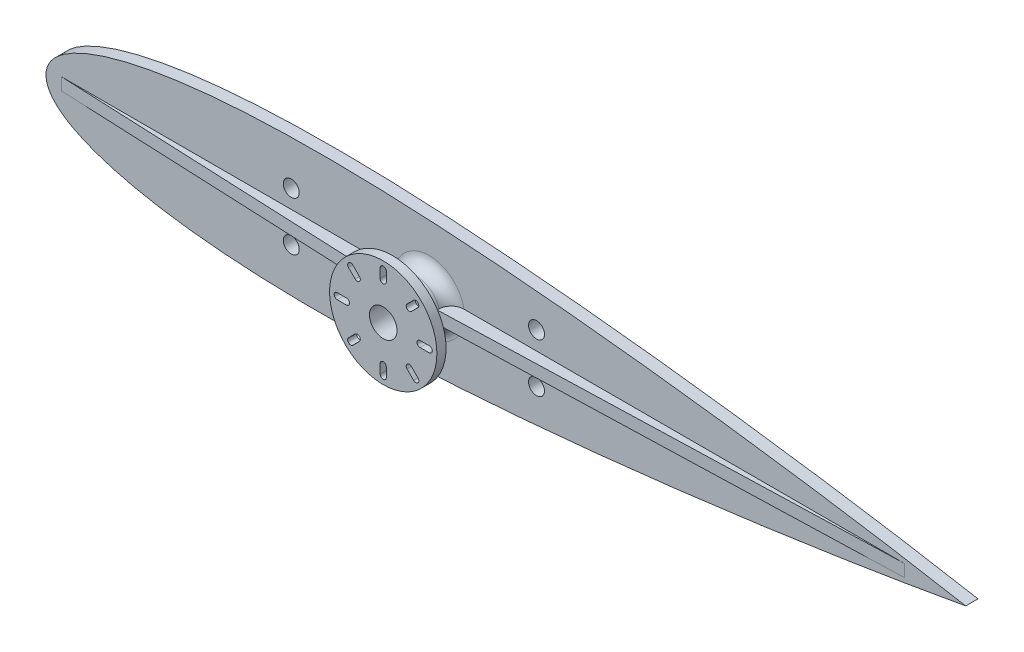
from build123d import *

# Parameters (mm, degrees)
SKETCH_1_R      = 4.5
SKETCH_1_R_2    = 2.6
EXTRUDE_1_DEPTH = 4
SKETCH_2_R      = 7.5
SKETCH_2_R_2    = 4.5
EXTRUDE_2_DEPTH = 12
RIB_7_REACH     = 303.268
SKETCH_4_WALL_W = 719.144994966
SKETCH_4_WALL_H = 4
RIB_8_REACH     = 303.268
SKETCH_5_WALL_W = 753.964961
SKETCH_5_WALL_H = 4
FILLET_1_R      = 4
SKETCH_6_R      = 17.5
SKETCH_6_R_2    = 4.5
EXTRUDE_3_DEPTH = 3


with BuildPart() as part:
    # 草图1 → 凸台-拉伸1 (new body)
    with BuildSketch(Plane.XY):
        with BuildLine():
            add(Edge.make_bspline(
                [(0, 0), (-9.5489e-05, -0.326407864), (0.030950281, -0.854000019), (0.150423202, -1.616777315), (0.448674258, -2.608935021), (0.848421592, -3.530047693), (1.433806351, -4.534449955), (2.263610744, -5.639668731), (3.456837907, -6.896675246), (5.225908513, -8.375867947), (7.906613431, -10.141837985), (11.989896233, -12.22562949), (18.321708513, -14.665606049), (27.826133031, -17.300188207), (41.974112353, -19.921000387), (60.222043604, -21.810463358), (78.624134319, -22.552186027), (95.988954389, -22.549739294), (113.345884106, -22.102249143), (130.689546496, -21.271088382), (148.01027967, -20.054961298), (165.306340091, -18.538013572), (179.703344131, -17.102052063), (191.21103146, -15.859228418), (201.272024493, -14.695659938), (209.889114389, -13.64726737), (217.06675899, -12.740467847), (222.804921516, -11.995811085), (229.977619163, -11.040364781), (238.573919489, -9.856643655), (248.605455284, -8.418167008), (258.611446595, -6.914785611), (267.201727162, -5.572315852), (274.322933639, -4.424865398), (280.072746677, -3.475406948), (285.700780324, -2.525508132), (290.829335304, -1.636879112), (294.873159607, -0.924080287), (298.04592284, -0.353968123), (299.35238804, -0.117662998), (300, 0)],
                knots=[0, 0, 0, 0, 0, 0.003840944, 0.006235023, 0.009072291, 0.01219322, 0.015656839, 0.019917177, 0.025338962, 0.032592504, 0.042799388, 0.05770457, 0.079310668, 0.112503101, 0.158972616, 0.227236465, 0.295500326, 0.329632258, 0.36376419, 0.432028053, 0.500291915, 0.534423847, 0.56855578, 0.602687711, 0.636819643, 0.653885609, 0.670951575, 0.688017542, 0.705083508, 0.739215439, 0.773347371, 0.807479302, 0.824545268, 0.841611234, 0.8586772, 0.875743167, 0.892809133, 0.901342117, 0.9098751, 0.9098751, 0.9098751, 0.9098751, 0.9098751], degree=4))
            add(Edge.make_bspline(
                [(0, 0), (-9.5489e-05, 0.326407864), (0.030950281, 0.854000019), (0.150423202, 1.616777315), (0.448674258, 2.608935021), (0.848421592, 3.530047693), (1.433806351, 4.534449955), (2.263610744, 5.639668731), (3.456837907, 6.896675246), (5.225908513, 8.375867947), (7.906613431, 10.141837985), (11.989896233, 12.22562949), (18.321708513, 14.665606049), (27.826133031, 17.300188207), (41.974112353, 19.921000387), (60.222043604, 21.810463358), (78.624134319, 22.552186027), (95.988954389, 22.549739295), (113.345884106, 22.102249143), (130.689546496, 21.271088382), (148.01027967, 20.054961298), (165.306340091, 18.538013572), (179.703344131, 17.102052063), (191.21103146, 15.859228418), (201.272024493, 14.695659938), (209.889114389, 13.64726737), (217.06675899, 12.740467847), (222.804921516, 11.995811086), (229.977619163, 11.040364781), (238.573919489, 9.856643655), (248.605455284, 8.418167008), (258.611446595, 6.914785611), (267.201727162, 5.572315852), (274.322933639, 4.424865398), (280.072746677, 3.475406948), (285.700780324, 2.525508132), (290.829335304, 1.636879112), (294.873159607, 0.924080288), (298.04592284, 0.353968123), (299.35238804, 0.117662998), (300, 0)],
                knots=[0, 0, 0, 0, 0, 0.003840944, 0.006235023, 0.009072291, 0.01219322, 0.015656839, 0.019917177, 0.025338962, 0.032592504, 0.042799388, 0.05770457, 0.079310668, 0.112503101, 0.158972616, 0.227236465, 0.295500326, 0.329632258, 0.36376419, 0.432028053, 0.500291915, 0.534423847, 0.56855578, 0.602687711, 0.636819643, 0.653885609, 0.670951575, 0.688017542, 0.705083508, 0.739215439, 0.773347371, 0.807479302, 0.824545268, 0.841611234, 0.8586772, 0.875743167, 0.892809133, 0.901342117, 0.9098751, 0.9098751, 0.9098751, 0.9098751, 0.9098751], degree=4))
        make_face()
        with Locations((125, 0)):
            Circle(SKETCH_1_R, mode=Mode.SUBTRACT)
        with Locations((80, -8)):
            Circle(SKETCH_1_R_2, mode=Mode.SUBTRACT)
        with Locations((160, -8)):
            Circle(SKETCH_1_R_2, mode=Mode.SUBTRACT)
        with Locations(Location((80, 8, 0), (0, 0, 180))):
            Circle(SKETCH_1_R_2, mode=Mode.SUBTRACT)
        with Locations(Location((160, 8, 0), (0, 0, 180))):
            Circle(SKETCH_1_R_2, mode=Mode.SUBTRACT)
    extrude(amount=EXTRUDE_1_DEPTH)

    # 草图2 → 凸台-拉伸2 (add)
    with BuildSketch(Plane.XY.offset(4)):
        with Locations((125, 0)):
            Circle(SKETCH_2_R)
        with Locations((125, 0)):
            Circle(SKETCH_2_R_2, mode=Mode.SUBTRACT)
    extrude(amount=EXTRUDE_2_DEPTH)

    # 草图4 wall → 筋7 (add, up to next)
    with BuildSketch(Plane(origin=(62.25, 0, 6.5), x_dir=(-0.999047908993, 0, -0.043626546244), z_dir=(-0.043626546244, 0, 0.999047908993)), mode=Mode.PRIVATE) as rib_7_sk1:
        Rectangle(SKETCH_4_WALL_W, SKETCH_4_WALL_H)
    rib_7_tool1 = extrude(rib_7_sk1.sketch, amount=-RIB_7_REACH, mode=Mode.PRIVATE) - part.part
    add(rib_7_tool1.solids().sort_by_distance((62.25, 0, 6.5))[0])

    # 草图5 wall → 筋8 (add, up to next)
    with BuildSketch(Plane(origin=(205.321523309, 0, 6.321191727), x_dir=(0.999517289679, 0, -0.031067469057), z_dir=(-0.031067469057, 0, -0.999517289679)), mode=Mode.PRIVATE) as rib_8_sk1:
        Rectangle(SKETCH_5_WALL_W, SKETCH_5_WALL_H)
    rib_8_tool1 = extrude(rib_8_sk1.sketch, amount=RIB_8_REACH, mode=Mode.PRIVATE) - part.part
    add(rib_8_tool1.solids().sort_by_distance((205.321523309, 0, 6.321191727))[0])

    # 圆角1
    fillet_1_edges = [part.edges().sort_by_distance(p)[0] for p in [
        (125, -7.5, 4),
        (125, 7.5, 4),
    ]]
    fillet(fillet_1_edges, radius=FILLET_1_R)

    # 草图6 → 凸台-拉伸3 (add)
    with BuildSketch(Plane.XY.offset(16)):
        with Locations((125, 0)):
            Circle(SKETCH_6_R)
        with Locations((125, 0)):
            Circle(SKETCH_6_R_2, mode=Mode.SUBTRACT)
        with BuildLine():
            Line((140, 1), (137, 1))
            ThreePointArc((137, 1), (136, 0), (137, -1))
            Line((137, -1), (140, -1))
            ThreePointArc((140, -1), (141, 0), (140, 1))
        make_face(mode=Mode.SUBTRACT)
        with BuildLine():
            Line((110, -1), (113, -1))
            ThreePointArc((113, -1), (114, 0), (113, 1))
            Line((113, 1), (110, 1))
            ThreePointArc((110, 1), (109, 0), (110, -1))
        make_face(mode=Mode.SUBTRACT)
        with BuildLine():
            Line((126, -15), (126, -12))
            ThreePointArc((126, -12), (125, -11), (124, -12))
            Line((124, -12), (124, -15))
            ThreePointArc((124, -15), (125, -16), (126, -15))
        make_face(mode=Mode.SUBTRACT)
        with BuildLine():
            Line((124, 15), (124, 12))
            ThreePointArc((124, 12), (125, 11), (126, 12))
            Line((126, 12), (126, 15))
            ThreePointArc((126, 15), (125, 16), (124, 15))
        make_face(mode=Mode.SUBTRACT)
        with BuildLine():
            Line((134.899494937, 11.313708499), (132.778174593, 9.192388155))
            ThreePointArc((132.778174593, 9.192388155), (132.778174593, 7.778174593), (134.192388155, 7.778174593))
            Line((134.192388155, 7.778174593), (136.313708499, 9.899494937))
            ThreePointArc((136.313708499, 9.899494937), (136.313708499, 11.313708499), (134.899494937, 11.313708499))
        make_face(mode=Mode.SUBTRACT)
        with BuildLine():
            Line((113.686291501, 9.899494937), (115.807611845, 7.778174593))
            ThreePointArc((115.807611845, 7.778174593), (117.221825407, 7.778174593), (117.221825407, 9.192388155))
            Line((117.221825407, 9.192388155), (115.100505063, 11.313708499))
            ThreePointArc((115.100505063, 11.313708499), (113.686291501, 11.313708499), (113.686291501, 9.899494937))
        make_face(mode=Mode.SUBTRACT)
        with BuildLine():
            Line((113.686291501, -9.899494937), (115.807611845, -7.778174593))
            ThreePointArc((115.807611845, -7.778174593), (117.221825407, -7.778174593), (117.221825407, -9.192388155))
            Line((117.221825407, -9.192388155), (115.100505063, -11.313708499))
            ThreePointArc((115.100505063, -11.313708499), (113.686291501, -11.313708499), (113.686291501, -9.899494937))
        make_face(mode=Mode.SUBTRACT)
        with BuildLine():
            Line((136.313708499, -9.899494937), (134.192388155, -7.778174593))
            ThreePointArc((134.192388155, -7.778174593), (132.778174593, -7.778174593), (132.778174593, -9.192388155))
            Line((132.778174593, -9.192388155), (134.899494937, -11.313708499))
            ThreePointArc((134.899494937, -11.313708499), (136.313708499, -11.313708499), (136.313708499, -9.899494937))
        make_face(mode=Mode.SUBTRACT)
    extrude(amount=EXTRUDE_3_DEPTH)


solid = part.part
